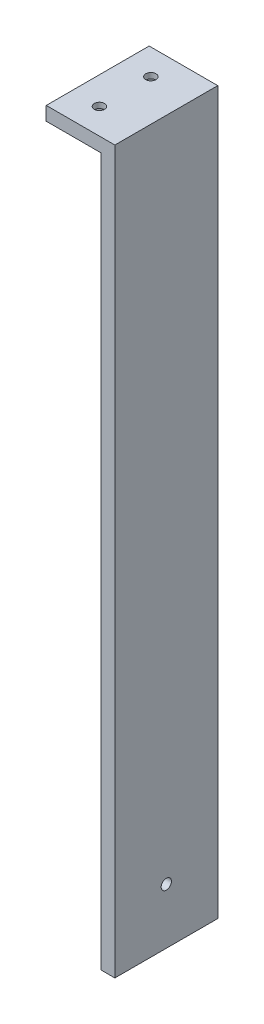
from build123d import *

# Parameters (mm, degrees)
EXTRU_MINCE1_DEPTH      = 38.1
ESQUISSE2_R             = 1.89865
ENL_V_MAT_EXTRU_1_DEPTH = 228.663979486
ENL_V_MAT_EXTRU_2_DEPTH = 3.048
D_GAGEMENT_61_D         = 3.7973


with BuildPart() as part:
    # Esquisse1 → Extru.-Mince1 (new body)
    with BuildSketch(Plane.XY):
        Polygon((90.805, 44.088736397), (116.205, 44.088736397), (116.205, -223.011474044), (111.125, -223.011474044), (111.125, 39.008736397), (90.805, 39.008736397), align=None)
    extrude(amount=-EXTRU_MINCE1_DEPTH)

    # Esquisse2 → Enlèv. mat.-Extru.1 (cut, through all)
    with BuildSketch(Plane(origin=(116.205, 0, 0), x_dir=(0, 0, -1), z_dir=(1, 0, 0))):
        with Locations(Location((19.05, -202.469224044, 0), (0, 0, 90))):
            Circle(ESQUISSE2_R)
    extrude(amount=-ENL_V_MAT_EXTRU_1_DEPTH, mode=Mode.SUBTRACT)

    # Esquisse3 → Enlèv. mat.-Extru.2 (cut)
    with BuildSketch(Plane.XZ.offset(-39.008736397)):
        Polygon((100.965, -23.735650044), (96.774, -26.155325022), (96.774, -30.994674978), (100.965, -33.414349956), (105.156, -30.994674978), (105.156, -26.155325022), align=None)
        Polygon((100.965, -4.685650044), (96.774, -7.105325022), (96.774, -11.944674978), (100.965, -14.364349956), (105.156, -11.944674978), (105.156, -7.105325022), align=None)
    extrude(amount=-ENL_V_MAT_EXTRU_2_DEPTH, mode=Mode.SUBTRACT)

    # Dégagement #61 (through all)
    with Locations(Plane(origin=(0, 42.056736397, 0), x_dir=(-1, 0, 0), z_dir=(0, -1, 0))):
        with Locations((-100.965, 28.575), (-100.965, 9.525)):
            Hole(D_GAGEMENT_61_D / 2)


solid = part.part
